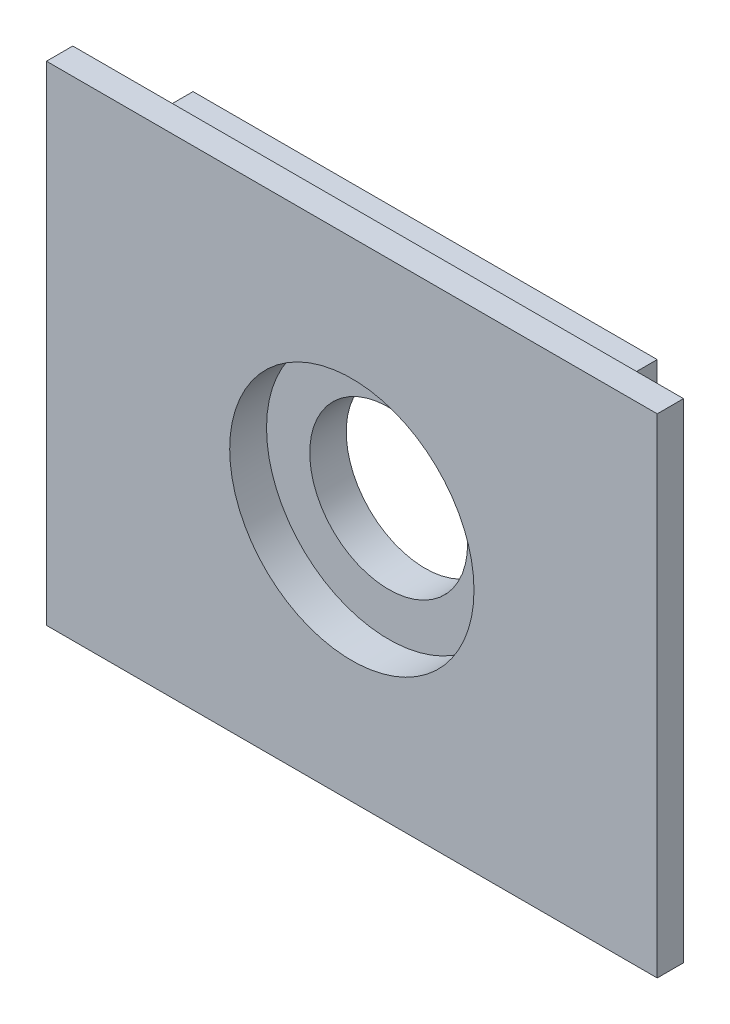
from build123d import *

# Parameters (mm, degrees)
SKETCH1_W           = 325
SKETCH1_H           = 260
BOSS_EXTRUDE1_DEPTH = 39
SKETCH2_R           = 65
CUT_EXTRUDE1_DEPTH  = 19.6
SKETCH3_R           = 42
CUT_EXTRUDE2_DEPTH  = 419.026314961
SKETCH4_W           = 325
SKETCH4_H           = 260
SKETCH4_W_2         = 247
SKETCH4_H_2         = 232
CUT_EXTRUDE3_DEPTH  = 25


with BuildPart() as part:
    # Sketch1 → Boss-Extrude1 (new body)
    with BuildSketch(Plane.XY):
        with Locations((162.5, 130)):
            Rectangle(SKETCH1_W, SKETCH1_H)
    extrude(amount=-BOSS_EXTRUDE1_DEPTH)

    # Sketch2 → Cut-Extrude1 (cut)
    with BuildSketch(Plane.XY):
        with Locations((162.5, 130)):
            Circle(SKETCH2_R)
    extrude(amount=-CUT_EXTRUDE1_DEPTH, mode=Mode.SUBTRACT)

    # Sketch3 → Cut-Extrude2 (cut, through all)
    with BuildSketch(Plane.XY):
        with Locations((162.5, 130)):
            Circle(SKETCH3_R)
    extrude(amount=-CUT_EXTRUDE2_DEPTH, mode=Mode.SUBTRACT)

    # Sketch4 → Cut-Extrude3 (cut)
    with BuildSketch(Plane(origin=(0, 0, -39), x_dir=(-1, 0, 0), z_dir=(0, 0, -1))):
        with Locations((-162.5, 130)):
            Rectangle(SKETCH4_W, SKETCH4_H)
        with Locations((-162.5, 130)):
            Rectangle(SKETCH4_W_2, SKETCH4_H_2, mode=Mode.SUBTRACT)
    extrude(amount=-CUT_EXTRUDE3_DEPTH, mode=Mode.SUBTRACT)


solid = part.part
